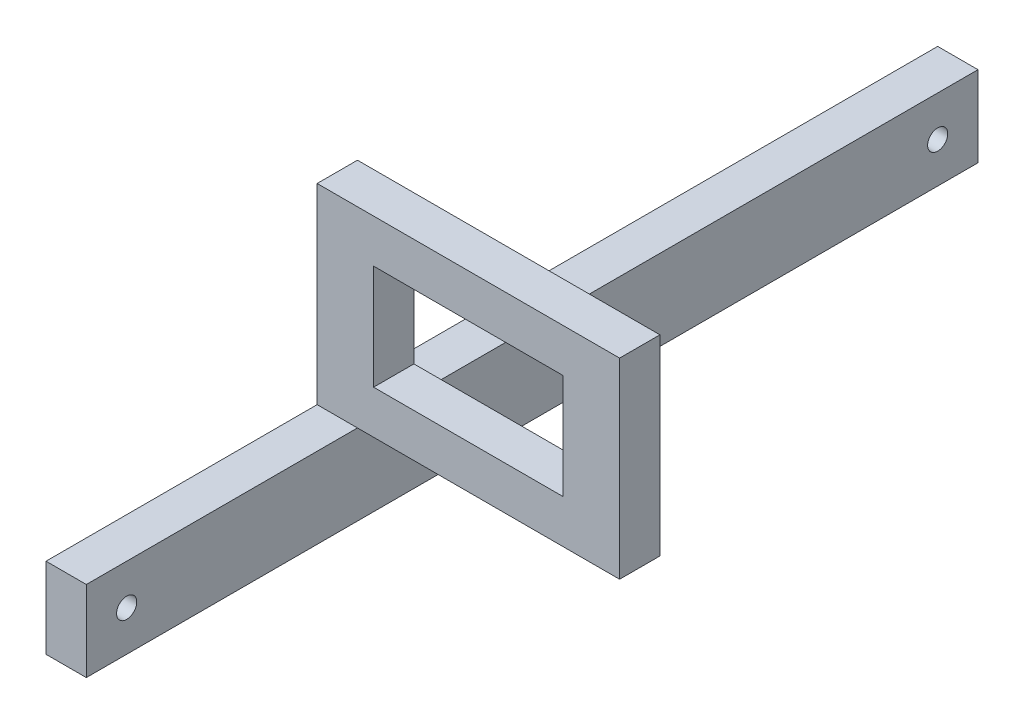
from build123d import *

# Parameters (mm, degrees)
SKETCH2_W                = 38.1
SKETCH2_H                = 24.13
BOSS_EXTRUDE1_DEPTH      = 5.08
SKETCH3_W                = 23.876
SKETCH3_H                = 13.208
CUT_EXTRUDE1_DEPTH       = 5.08
BOSS_EXTRUDE2_DEPTH      = 34.154802
BOSS_EXTRUDE2_DEPTH_BACK = 78.16772
SKETCH4_W                = 5.08
SKETCH4_H                = 10.16
CUT_EXTRUDE2_REACH       = 87.366
SKETCH5_R                = 1.27


with BuildPart() as part:
    # Sketch2 → Boss-Extrude1 (new body)
    with BuildSketch(Plane.XY):
        Rectangle(SKETCH2_W, SKETCH2_H)
    extrude(amount=BOSS_EXTRUDE1_DEPTH)

    # Sketch3 → Cut-Extrude1 (cut)
    with BuildSketch(Plane.XY.offset(5.08)):
        Rectangle(SKETCH3_W, SKETCH3_H)
    extrude(amount=-CUT_EXTRUDE1_DEPTH, mode=Mode.SUBTRACT)

    # Sketch4 → Boss-Extrude2 (add, two sides: drawn at the far end of the back side and taken through both)
    with BuildSketch(Plane.XY.offset(5.08).offset(-BOSS_EXTRUDE2_DEPTH_BACK)):
        with Locations((-16.51, -17.145)):
            Rectangle(SKETCH4_W, SKETCH4_H)
    extrude(amount=BOSS_EXTRUDE2_DEPTH + BOSS_EXTRUDE2_DEPTH_BACK)

    # Sketch5 → Cut-Extrude2 (cut, up to next)
    with BuildSketch(Plane.ZY.offset(19.05), mode=Mode.PRIVATE) as cut_extrude2_sk1:
        with Locations((-68.007719547, -17.145)):
            Circle(SKETCH5_R)
    cut_extrude2_tool1 = extrude(cut_extrude2_sk1.sketch, amount=-CUT_EXTRUDE2_REACH, mode=Mode.PRIVATE) & part.part
    # Sketch5 → Cut-Extrude2 (cut, up to next)
    with BuildSketch(Plane.ZY.offset(19.05), mode=Mode.PRIVATE) as cut_extrude2_sk2:
        with Locations((34.154802315, -17.145)):
            Circle(SKETCH5_R)
    cut_extrude2_tool2 = extrude(cut_extrude2_sk2.sketch, amount=-CUT_EXTRUDE2_REACH, mode=Mode.PRIVATE) & part.part
    add(cut_extrude2_tool1.solids().sort_by_distance((-19.05, -17.145, -68.00772))[0], mode=Mode.SUBTRACT)
    add(cut_extrude2_tool2.solids().sort_by_distance((-19.05, -17.145, 34.154802))[0], mode=Mode.SUBTRACT)


solid = part.part
